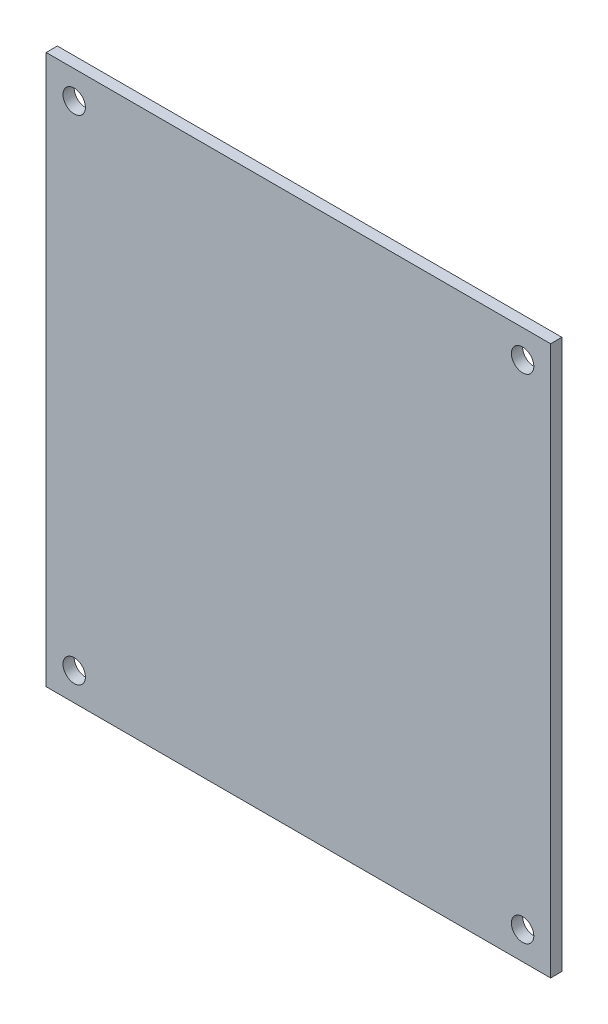
from build123d import *

# Parameters (mm, degrees)
SKETCH1_W                = 135
SKETCH1_H                = 147
BOSS_EXTRUDE1_DEPTH      = 3
F_6_0_6_DIAMETER_HOLE1_D = 6


with BuildPart() as part:
    # Sketch1 → Boss-Extrude1 (new body)
    with BuildSketch(Plane.XY):
        Rectangle(SKETCH1_W, SKETCH1_H)
    extrude(amount=BOSS_EXTRUDE1_DEPTH)

    # Ø6.0 (6) Diameter Hole1 (through all)
    with Locations(Plane.XY.offset(3)):
        with Locations((60, -66), (-60, -66), (-60, 66), (60, 66)):
            Hole(F_6_0_6_DIAMETER_HOLE1_D / 2)


solid = part.part
